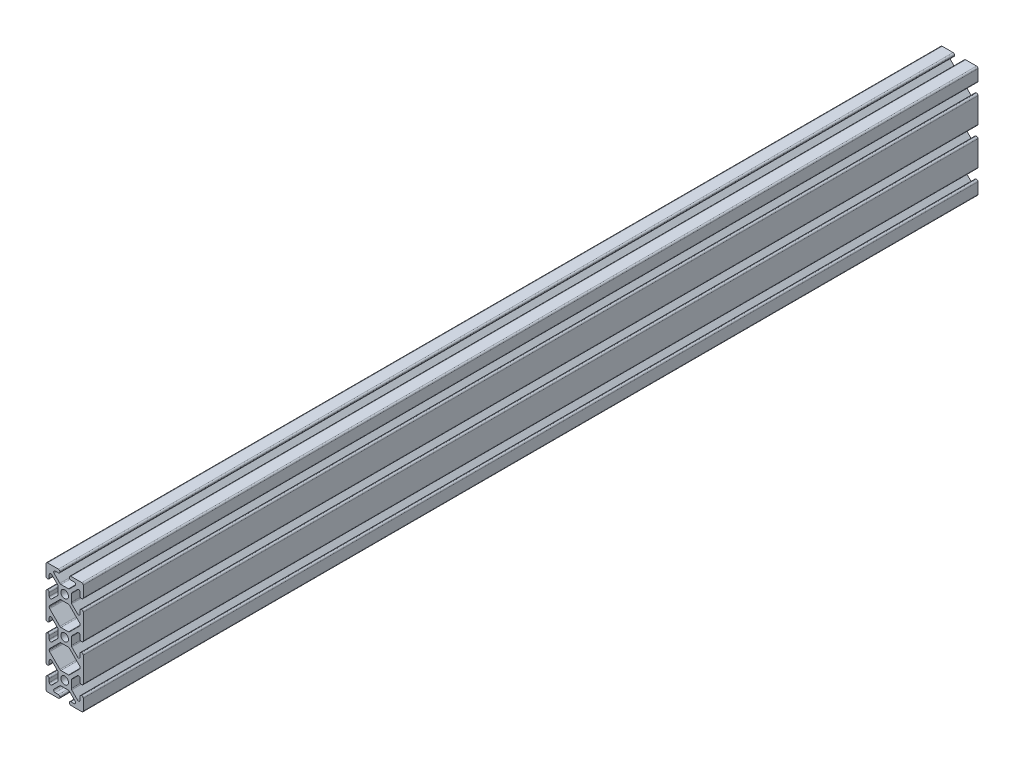
from build123d import *

# Parameters (mm, degrees)
SKETCH1_R            = 2.6035
MAIN_EXTRUSION_DEPTH = 304.8


with BuildPart() as part:
    # Sketch1 → Main Extrusion (new, symmetric)
    with BuildSketch(Plane.XY):
        with BuildLine():
            Line((-12.7, 37.084), (-12.7, 29.6672))
            ThreePointArc((-12.7, 29.6672), (-12.40242049, 28.94877951), (-11.684, 28.6512))
            Line((-11.684, 28.6512), (-11.5062, 28.6512))
            ThreePointArc((-11.5062, 28.6512), (-10.78777951, 28.94877951), (-10.4902, 29.6672))
            Line((-10.4902, 29.6672), (-10.4902, 31.874794456))
            ThreePointArc((-10.4902, 31.874794456), (-9.863006367, 32.813456061), (-8.75577951, 32.593214945))
            Line((-8.75577951, 32.593214945), (-4.81877951, 28.656214945))
            ThreePointArc((-4.81877951, 28.656214945), (-4.598538395, 28.326600823), (-4.5212, 27.937794456))
            Line((-4.5212, 27.937794456), (-4.5212, 22.862205544))
            ThreePointArc((-4.5212, 22.862205544), (-4.598538395, 22.473399177), (-4.81877951, 22.143785055))
            Line((-4.81877951, 22.143785055), (-8.75577951, 18.206785055))
            ThreePointArc((-8.75577951, 18.206785055), (-9.863006367, 17.986543939), (-10.4902, 18.925205544))
            Line((-10.4902, 18.925205544), (-10.4902, 21.1328))
            ThreePointArc((-10.4902, 21.1328), (-10.78777951, 21.85122049), (-11.5062, 22.1488))
            Line((-11.5062, 22.1488), (-11.684, 22.1488))
            ThreePointArc((-11.684, 22.1488), (-12.40242049, 21.85122049), (-12.7, 21.1328))
            Line((-12.7, 21.1328), (-12.7, 4.2672))
            ThreePointArc((-12.7, 4.2672), (-12.40242049, 3.54877951), (-11.684, 3.2512))
            Line((-11.684, 3.2512), (-11.5062, 3.2512))
            ThreePointArc((-11.5062, 3.2512), (-10.78777951, 3.54877951), (-10.4902, 4.2672))
            Line((-10.4902, 4.2672), (-10.4902, 6.474794456))
            ThreePointArc((-10.4902, 6.474794456), (-9.863006367, 7.413456061), (-8.75577951, 7.193214945))
            Line((-8.75577951, 7.193214945), (-4.81877951, 3.256214945))
            ThreePointArc((-4.81877951, 3.256214945), (-4.598538395, 2.926600823), (-4.5212, 2.537794456))
            Line((-4.5212, 2.537794456), (-4.5212, -2.537794456))
            ThreePointArc((-4.5212, -2.537794456), (-4.598538395, -2.926600823), (-4.81877951, -3.256214945))
            Line((-4.81877951, -3.256214945), (-8.75577951, -7.193214945))
            ThreePointArc((-8.75577951, -7.193214945), (-9.863006367, -7.413456061), (-10.4902, -6.474794456))
            Line((-10.4902, -6.474794456), (-10.4902, -4.2672))
            ThreePointArc((-10.4902, -4.2672), (-10.78777951, -3.54877951), (-11.5062, -3.2512))
            Line((-11.5062, -3.2512), (-11.684, -3.2512))
            ThreePointArc((-11.684, -3.2512), (-12.40242049, -3.54877951), (-12.7, -4.2672))
            Line((-12.7, -4.2672), (-12.7, -21.1328))
            ThreePointArc((-12.7, -21.1328), (-12.40242049, -21.85122049), (-11.684, -22.1488))
            Line((-11.684, -22.1488), (-11.5062, -22.1488))
            ThreePointArc((-11.5062, -22.1488), (-10.78777951, -21.85122049), (-10.4902, -21.1328))
            Line((-10.4902, -21.1328), (-10.4902, -18.925205544))
            ThreePointArc((-10.4902, -18.925205544), (-9.863006367, -17.986543939), (-8.75577951, -18.206785055))
            Line((-8.75577951, -18.206785055), (-4.81877951, -22.143785055))
            ThreePointArc((-4.81877951, -22.143785055), (-4.598538395, -22.473399177), (-4.5212, -22.862205544))
            Line((-4.5212, -22.862205544), (-4.5212, -27.937794456))
            ThreePointArc((-4.5212, -27.937794456), (-4.598538395, -28.326600823), (-4.81877951, -28.656214945))
            Line((-4.81877951, -28.656214945), (-8.75577951, -32.593214945))
            ThreePointArc((-8.75577951, -32.593214945), (-9.863006367, -32.813456061), (-10.4902, -31.874794456))
            Line((-10.4902, -31.874794456), (-10.4902, -29.6672))
            ThreePointArc((-10.4902, -29.6672), (-10.78777951, -28.94877951), (-11.5062, -28.6512))
            Line((-11.5062, -28.6512), (-11.684, -28.6512))
            ThreePointArc((-11.684, -28.6512), (-12.40242049, -28.94877951), (-12.7, -29.6672))
            Line((-12.7, -29.6672), (-12.7, -37.084))
            ThreePointArc((-12.7, -37.084), (-12.40242049, -37.80242049), (-11.684, -38.1))
            Line((-11.684, -38.1), (-4.2672, -38.1))
            ThreePointArc((-4.2672, -38.1), (-3.54877951, -37.80242049), (-3.2512, -37.084))
            Line((-3.2512, -37.084), (-3.2512, -36.9062))
            ThreePointArc((-3.2512, -36.9062), (-3.54877951, -36.18777951), (-4.2672, -35.8902))
            Line((-4.2672, -35.8902), (-6.474794456, -35.8902))
            ThreePointArc((-6.474794456, -35.8902), (-7.413456061, -35.263006367), (-7.193214945, -34.15577951))
            Line((-7.193214945, -34.15577951), (-3.256214945, -30.21877951))
            ThreePointArc((-3.256214945, -30.21877951), (-2.926600823, -29.998538395), (-2.537794456, -29.9212))
            Line((-2.537794456, -29.9212), (2.537794456, -29.9212))
            ThreePointArc((2.537794456, -29.9212), (2.926600823, -29.998538395), (3.256214945, -30.21877951))
            Line((3.256214945, -30.21877951), (7.193214945, -34.15577951))
            ThreePointArc((7.193214945, -34.15577951), (7.413456061, -35.263006367), (6.474794456, -35.8902))
            Line((6.474794456, -35.8902), (4.2672, -35.8902))
            ThreePointArc((4.2672, -35.8902), (3.54877951, -36.18777951), (3.2512, -36.9062))
            Line((3.2512, -36.9062), (3.2512, -37.084))
            ThreePointArc((3.2512, -37.084), (3.54877951, -37.80242049), (4.2672, -38.1))
            Line((4.2672, -38.1), (11.684, -38.1))
            ThreePointArc((11.684, -38.1), (12.40242049, -37.80242049), (12.7, -37.084))
            Line((12.7, -37.084), (12.7, -29.6672))
            ThreePointArc((12.7, -29.6672), (12.40242049, -28.94877951), (11.684, -28.6512))
            Line((11.684, -28.6512), (11.5062, -28.6512))
            ThreePointArc((11.5062, -28.6512), (10.78777951, -28.94877951), (10.4902, -29.6672))
            Line((10.4902, -29.6672), (10.4902, -31.874794456))
            ThreePointArc((10.4902, -31.874794456), (9.863006367, -32.813456061), (8.75577951, -32.593214945))
            Line((8.75577951, -32.593214945), (4.81877951, -28.656214945))
            ThreePointArc((4.81877951, -28.656214945), (4.598538395, -28.326600823), (4.5212, -27.937794456))
            Line((4.5212, -27.937794456), (4.5212, -22.862205544))
            ThreePointArc((4.5212, -22.862205544), (4.598538395, -22.473399177), (4.81877951, -22.143785055))
            Line((4.81877951, -22.143785055), (8.75577951, -18.206785055))
            ThreePointArc((8.75577951, -18.206785055), (9.863006367, -17.986543939), (10.4902, -18.925205544))
            Line((10.4902, -18.925205544), (10.4902, -21.1328))
            ThreePointArc((10.4902, -21.1328), (10.78777951, -21.85122049), (11.5062, -22.1488))
            Line((11.5062, -22.1488), (11.684, -22.1488))
            ThreePointArc((11.684, -22.1488), (12.40242049, -21.85122049), (12.7, -21.1328))
            Line((12.7, -21.1328), (12.7, -4.2672))
            ThreePointArc((12.7, -4.2672), (12.40242049, -3.54877951), (11.684, -3.2512))
            Line((11.684, -3.2512), (11.5062, -3.2512))
            ThreePointArc((11.5062, -3.2512), (10.78777951, -3.54877951), (10.4902, -4.2672))
            Line((10.4902, -4.2672), (10.4902, -6.474794456))
            ThreePointArc((10.4902, -6.474794456), (9.863006367, -7.413456061), (8.75577951, -7.193214945))
            Line((8.75577951, -7.193214945), (4.81877951, -3.256214945))
            ThreePointArc((4.81877951, -3.256214945), (4.598538395, -2.926600823), (4.5212, -2.537794456))
            Line((4.5212, -2.537794456), (4.5212, 2.537794456))
            ThreePointArc((4.5212, 2.537794456), (4.598538395, 2.926600823), (4.81877951, 3.256214945))
            Line((4.81877951, 3.256214945), (8.75577951, 7.193214945))
            ThreePointArc((8.75577951, 7.193214945), (9.863006367, 7.413456061), (10.4902, 6.474794456))
            Line((10.4902, 6.474794456), (10.4902, 4.2672))
            ThreePointArc((10.4902, 4.2672), (10.78777951, 3.54877951), (11.5062, 3.2512))
            Line((11.5062, 3.2512), (11.684, 3.2512))
            ThreePointArc((11.684, 3.2512), (12.40242049, 3.54877951), (12.7, 4.2672))
            Line((12.7, 4.2672), (12.7, 21.1328))
            ThreePointArc((12.7, 21.1328), (12.40242049, 21.85122049), (11.684, 22.1488))
            Line((11.684, 22.1488), (11.5062, 22.1488))
            ThreePointArc((11.5062, 22.1488), (10.78777951, 21.85122049), (10.4902, 21.1328))
            Line((10.4902, 21.1328), (10.4902, 18.925205544))
            ThreePointArc((10.4902, 18.925205544), (9.863006367, 17.986543939), (8.75577951, 18.206785055))
            Line((8.75577951, 18.206785055), (4.81877951, 22.143785055))
            ThreePointArc((4.81877951, 22.143785055), (4.598538395, 22.473399177), (4.5212, 22.862205544))
            Line((4.5212, 22.862205544), (4.5212, 27.937794456))
            ThreePointArc((4.5212, 27.937794456), (4.598538395, 28.326600823), (4.81877951, 28.656214945))
            Line((4.81877951, 28.656214945), (8.75577951, 32.593214945))
            ThreePointArc((8.75577951, 32.593214945), (9.863006367, 32.813456061), (10.4902, 31.874794456))
            Line((10.4902, 31.874794456), (10.4902, 29.6672))
            ThreePointArc((10.4902, 29.6672), (10.78777951, 28.94877951), (11.5062, 28.6512))
            Line((11.5062, 28.6512), (11.684, 28.6512))
            ThreePointArc((11.684, 28.6512), (12.40242049, 28.94877951), (12.7, 29.6672))
            Line((12.7, 29.6672), (12.7, 37.084))
            ThreePointArc((12.7, 37.084), (12.40242049, 37.80242049), (11.684, 38.1))
            Line((11.684, 38.1), (4.2672, 38.1))
            ThreePointArc((4.2672, 38.1), (3.54877951, 37.80242049), (3.2512, 37.084))
            Line((3.2512, 37.084), (3.2512, 36.9062))
            ThreePointArc((3.2512, 36.9062), (3.54877951, 36.18777951), (4.2672, 35.8902))
            Line((4.2672, 35.8902), (6.474794456, 35.8902))
            ThreePointArc((6.474794456, 35.8902), (7.413456061, 35.263006367), (7.193214945, 34.15577951))
            Line((7.193214945, 34.15577951), (3.256214945, 30.21877951))
            ThreePointArc((3.256214945, 30.21877951), (2.926600823, 29.998538395), (2.537794456, 29.9212))
            Line((2.537794456, 29.9212), (-2.537794456, 29.9212))
            ThreePointArc((-2.537794456, 29.9212), (-2.926600823, 29.998538395), (-3.256214945, 30.21877951))
            Line((-3.256214945, 30.21877951), (-7.193214945, 34.15577951))
            ThreePointArc((-7.193214945, 34.15577951), (-7.413456061, 35.263006367), (-6.474794456, 35.8902))
            Line((-6.474794456, 35.8902), (-4.2672, 35.8902))
            ThreePointArc((-4.2672, 35.8902), (-3.54877951, 36.18777951), (-3.2512, 36.9062))
            Line((-3.2512, 36.9062), (-3.2512, 37.084))
            ThreePointArc((-3.2512, 37.084), (-3.54877951, 37.80242049), (-4.2672, 38.1))
            Line((-4.2672, 38.1), (-11.684, 38.1))
            ThreePointArc((-11.684, 38.1), (-12.40242049, 37.80242049), (-12.7, 37.084))
        make_face()
        with Locations(Location((0, 25.4, 0), (0, 0, 180))):
            Circle(SKETCH1_R, mode=Mode.SUBTRACT)
        with Locations(Location((0, 0, 0), (0, 0, 180))):
            Circle(SKETCH1_R, mode=Mode.SUBTRACT)
        with Locations(Location((0, -25.4, 0), (0, 0, 180))):
            Circle(SKETCH1_R, mode=Mode.SUBTRACT)
        with BuildLine():
            Line((-10.4902, 12.473605544), (-10.4902, 12.926394456))
            ThreePointArc((-10.4902, 12.926394456), (-10.412861605, 13.315200823), (-10.19262049, 13.644814945))
            Line((-10.19262049, 13.644814945), (-3.256214945, 20.58122049))
            ThreePointArc((-3.256214945, 20.58122049), (-2.926600823, 20.801461605), (-2.537794456, 20.8788))
            Line((-2.537794456, 20.8788), (2.537794456, 20.8788))
            ThreePointArc((2.537794456, 20.8788), (2.926600823, 20.801461605), (3.256214945, 20.58122049))
            Line((3.256214945, 20.58122049), (10.19262049, 13.644814945))
            ThreePointArc((10.19262049, 13.644814945), (10.412861605, 13.315200823), (10.4902, 12.926394456))
            Line((10.4902, 12.926394456), (10.4902, 12.473605544))
            ThreePointArc((10.4902, 12.473605544), (10.412861605, 12.084799177), (10.19262049, 11.755185055))
            Line((10.19262049, 11.755185055), (3.256214945, 4.81877951))
            ThreePointArc((3.256214945, 4.81877951), (2.926600823, 4.598538395), (2.537794456, 4.5212))
            Line((2.537794456, 4.5212), (-2.537794456, 4.5212))
            ThreePointArc((-2.537794456, 4.5212), (-2.926600823, 4.598538395), (-3.256214945, 4.81877951))
            Line((-3.256214945, 4.81877951), (-10.19262049, 11.755185055))
            ThreePointArc((-10.19262049, 11.755185055), (-10.412861605, 12.084799177), (-10.4902, 12.473605544))
        make_face(mode=Mode.SUBTRACT)
        with BuildLine():
            Line((-2.537794456, -4.5212), (2.537794456, -4.5212))
            ThreePointArc((2.537794456, -4.5212), (2.926600823, -4.598538395), (3.256214945, -4.81877951))
            Line((3.256214945, -4.81877951), (10.19262049, -11.755185055))
            ThreePointArc((10.19262049, -11.755185055), (10.412861605, -12.084799177), (10.4902, -12.473605544))
            Line((10.4902, -12.473605544), (10.4902, -12.926394456))
            ThreePointArc((10.4902, -12.926394456), (10.412861605, -13.315200823), (10.19262049, -13.644814945))
            Line((10.19262049, -13.644814945), (3.256214945, -20.58122049))
            ThreePointArc((3.256214945, -20.58122049), (2.926600823, -20.801461605), (2.537794456, -20.8788))
            Line((2.537794456, -20.8788), (-2.537794456, -20.8788))
            ThreePointArc((-2.537794456, -20.8788), (-2.926600823, -20.801461605), (-3.256214945, -20.58122049))
            Line((-3.256214945, -20.58122049), (-10.19262049, -13.644814945))
            ThreePointArc((-10.19262049, -13.644814945), (-10.412861605, -13.315200823), (-10.4902, -12.926394456))
            Line((-10.4902, -12.926394456), (-10.4902, -12.473605544))
            ThreePointArc((-10.4902, -12.473605544), (-10.412861605, -12.084799177), (-10.19262049, -11.755185055))
            Line((-10.19262049, -11.755185055), (-3.256214945, -4.81877951))
            ThreePointArc((-3.256214945, -4.81877951), (-2.926600823, -4.598538395), (-2.537794456, -4.5212))
        make_face(mode=Mode.SUBTRACT)
    extrude(amount=MAIN_EXTRUSION_DEPTH, both=True)


solid = part.part
